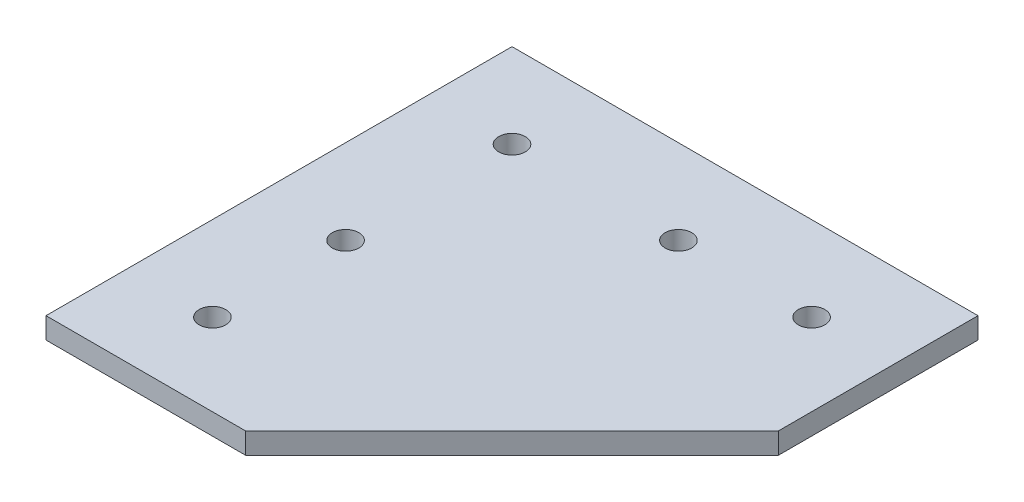
from build123d import *

# Parameters (mm, degrees)
SKETCH2_W             = 70
SKETCH2_H             = 70
BOSS_EXTRUDE1_DEPTH   = 3.175
F_4_0MM_DOWEL_HOLE1_D = 4
CUT_EXTRUDE1_DEPTH    = 50.599199842


with BuildPart() as part:
    # Sketch2 → Boss-Extrude1 (new body)
    with BuildSketch(Plane(origin=(0, 0, 0), x_dir=(1, 0, 0), z_dir=(0, 1, 0))):
        Rectangle(SKETCH2_W, SKETCH2_H)
    extrude(amount=BOSS_EXTRUDE1_DEPTH)

    # Ø4.0mm Dowel Hole1 (through all)
    with Locations(Plane(origin=(0, 3.175, 0), x_dir=(1, 0, 0), z_dir=(0, 1, 0))):
        with Locations((-22.3, 22.3), (22.7, 22.3), (2.7, 22.3), (-22.3, -2.7), (-22.3, -22.7)):
            Hole(F_4_0MM_DOWEL_HOLE1_D / 2)

    # Sketch8 → Cut-Extrude1 (cut, through all)
    with BuildSketch(Plane(origin=(0, 3.175, 0), x_dir=(1, 0, 0), z_dir=(0, 1, 0))):
        Polygon((-5, -35), (35, 5), (35, -35), align=None)
    extrude(amount=-CUT_EXTRUDE1_DEPTH, mode=Mode.SUBTRACT)


solid = part.part
